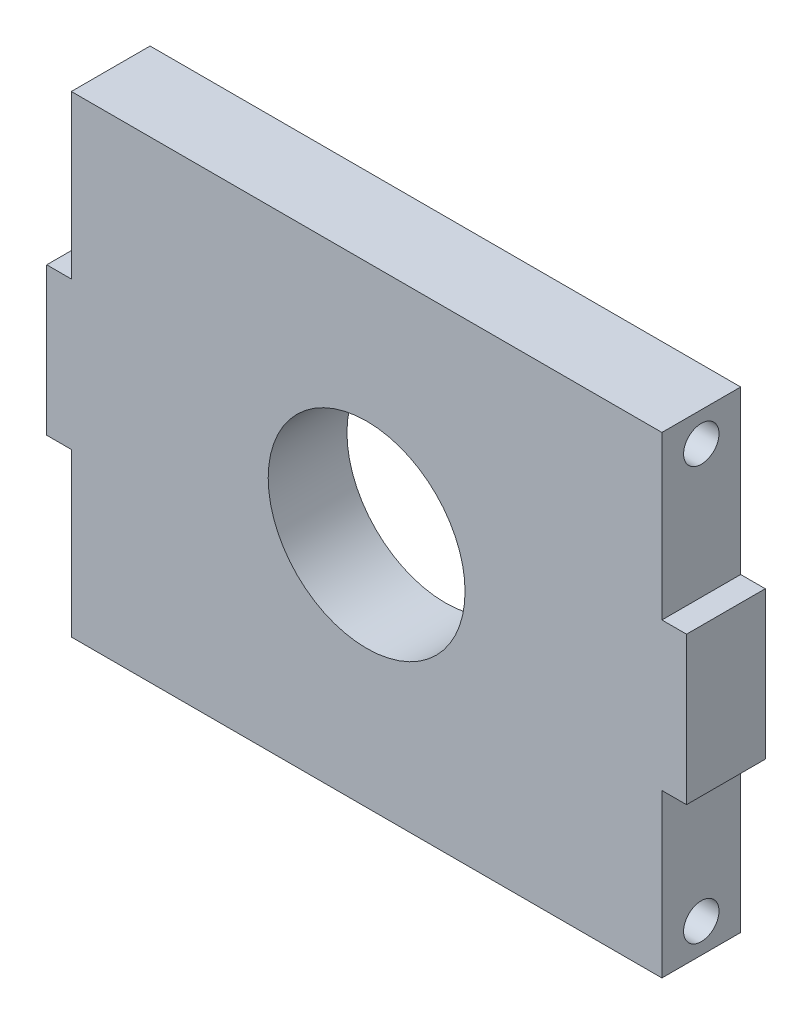
from build123d import *

# Parameters (mm, degrees)
SKETCH_1_W               = 60
SKETCH_1_H               = 48
EXTRUDE_1_DEPTH          = 8
SKETCH_3_W               = 65
SKETCH_3_H               = 15
EXTRUDE_2_DEPTH          = 8
SKETCH_5_R               = 1.8
CUT_EXTRUDE_1_DEPTH      = 3
MIRROR_3_COPY_1_SKETCH_R = 1.8
MIRROR_3_COPY_1_DEPTH    = 3
MIRROR_3_COPY_2_SKETCH_R = 1.8
MIRROR_3_COPY_2_DEPTH    = 3
SKETCH_7_R               = 10
CUT_EXTRUDE_2_DEPTH      = 8


with BuildPart() as part:
    # 草图1 → 凸台-拉伸1 (new body)
    with BuildSketch(Plane.XY):
        Rectangle(SKETCH_1_W, SKETCH_1_H)
    extrude(amount=EXTRUDE_1_DEPTH)

    # 草图3 → 凸台-拉伸2 (add)
    with BuildSketch(Plane.XY.offset(8)):
        Rectangle(SKETCH_3_W, SKETCH_3_H)
    extrude(amount=-EXTRUDE_2_DEPTH)

    # 草图5 → 切除-拉伸1 (cut)
    with BuildSketch(Plane(origin=(30, 0, 0), x_dir=(0, 0, -1), z_dir=(1, 0, 0))):
        with Locations((-4, 21)):
            Circle(SKETCH_5_R)
    cut_extrude_1 = extrude(amount=-CUT_EXTRUDE_1_DEPTH, mode=Mode.SUBTRACT)

    # 镜向2: 切除-拉伸1 across plane
    add(cut_extrude_1.mirror(Plane.ZX), mode=Mode.SUBTRACT)

    # 镜向3 copy 1 sketch → 镜向3 copy 1 (cut)
    with BuildSketch(Plane(origin=(-30, 0, 0), x_dir=(0, 0, -1), z_dir=(-1, 0, 0))):
        with Locations((-4, 21)):
            Circle(MIRROR_3_COPY_1_SKETCH_R)
    extrude(amount=-MIRROR_3_COPY_1_DEPTH, mode=Mode.SUBTRACT)

    # 镜向3 copy 2 sketch → 镜向3 copy 2 (cut)
    with BuildSketch(Plane(origin=(-30, 0, 0), x_dir=(0, 0, -1), z_dir=(-1, 0, 0))):
        with Locations((-4, -21)):
            Circle(MIRROR_3_COPY_2_SKETCH_R)
    extrude(amount=-MIRROR_3_COPY_2_DEPTH, mode=Mode.SUBTRACT)

    # 草图7 → 切除-拉伸2 (cut)
    with BuildSketch(Plane.XY.offset(8)):
        Circle(SKETCH_7_R)
    extrude(amount=-CUT_EXTRUDE_2_DEPTH, mode=Mode.SUBTRACT)


solid = part.part
